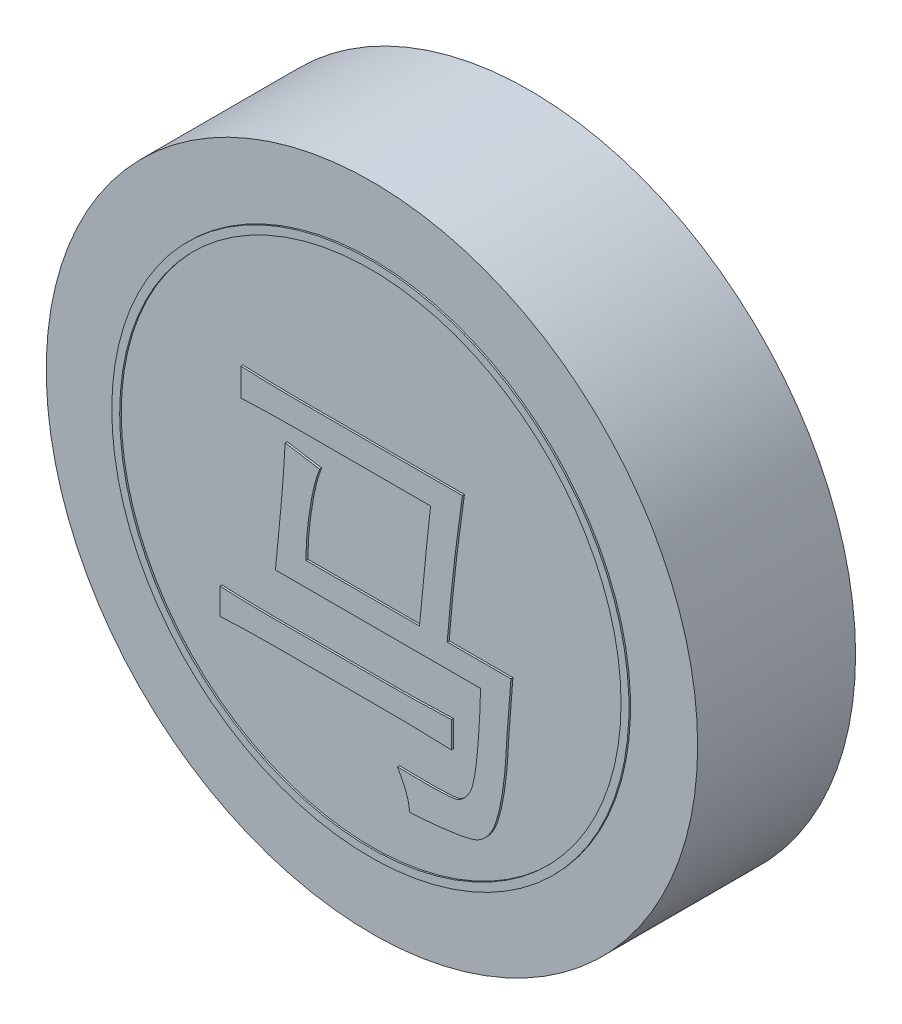
from build123d import *

# Parameters (mm, degrees)
SKETCH_1_R               = 16.5
DIAMETER33_HEIGHT8_DEPTH = 8
CHARACTER_DEPTH          = 0.1
SKETCH_3_R               = 13.1
SKETCH_3_R_2             = 12.7
INK_RING_DEPTH           = 0.08


with BuildPart() as part:
    # 草图1 → Diameter33_Height8 (new body)
    with BuildSketch(Plane.XY):
        Circle(SKETCH_1_R)
    extrude(amount=-DIAMETER33_HEIGHT8_DEPTH)

    # 草图2 → Character_马 (add)
    with BuildSketch(Plane.XY):
        with BuildLine():
            add(Edge.make_bspline(
                [(-2.543859649, 2.657894737), (-2.568109523, 2.601908638), (-2.618944351, 2.484545403), (-2.68091831, 2.29374228), (-2.747882739, 2.084905171), (-2.809197893, 1.853949883), (-2.867938942, 1.601351852), (-2.929388828, 1.329074257), (-2.981674213, 1.034530608), (-3.05538164, 0.620649676), (-3.127595616, 0.098084884), (-3.197623224, -0.517816396), (-3.237414282, -1.112851594), (-3.242919292, -1.502329954), (-3.245614035, -1.692982456)],
                knots=[0, 0, 0, 0, 0.495689669, 1.0391105, 1.629386371, 2.27856569, 2.980637221, 3.737641002, 4.547078417, 5.411969332, 7.15491927, 8.834024839, 10.450232028, 12, 12, 12, 12], degree=3))
            Line((-3.245614035, -1.692982456), (2.50877193, -1.692982456))
            add(Edge.make_bspline(
                [(2.50877193, -1.692982456), (2.555842668, -1.219109546), (2.651092154, -0.26020911), (2.765765857, 0.939059138), (2.857689962, 1.892225125), (2.928191701, 2.576627854), (2.997770846, 3.225611417), (3.046502797, 3.646446892), (3.070175439, 3.850877193)],
                knots=[0, 0, 0, 0, 1.538264342, 3.112738277, 3.891618687, 4.631513556, 5.335226919, 6, 6, 6, 6], degree=3))
            Line((3.070175439, 3.850877193), (-3.666666667, 3.850877193))
            add(Edge.make_bspline(
                [(-3.666666667, 3.850877193), (-3.893660384, 3.849684604), (-4.355478431, 3.847258285), (-5.06158577, 3.833290973), (-5.793776141, 3.813732), (-6.290908298, 3.791840575), (-6.543859649, 3.780701754)],
                knots=[0, 0, 0, 0, 0.946376728, 1.925400653, 2.944399995, 4, 4, 4, 4], degree=3))
            Line((-6.543859649, 3.780701754), (-6.543859649, 5.184210526))
            add(Edge.make_bspline(
                [(-6.543859649, 5.184210526), (-6.290908298, 5.173071706), (-5.793776141, 5.15118028), (-5.06158577, 5.131621308), (-4.355478431, 5.117653996), (-3.893660384, 5.115227677), (-3.666666667, 5.114035088)],
                knots=[0, 0, 0, 0, 1.055600005, 2.074599347, 3.053623272, 4, 4, 4, 4], degree=3))
            Line((-3.666666667, 5.114035088), (4.684210526, 5.114035088))
            add(Edge.make_bspline(
                [(4.684210526, 5.114035088), (4.594389665, 4.480170947), (4.4139847, 3.207056477), (4.243054526, 1.774416685), (4.14478495, 0.828967937), (4.097381465, 0.388144624), (4.055421695, -0.025950303), (4.020061293, -0.412530658), (3.985399458, -0.77104386), (3.956533585, -1.101987754), (3.933708028, -1.406199086), (3.919206962, -1.600281379), (3.912280702, -1.692982456)],
                knots=[0, 0, 0, 0, 2.802935976, 5.629689589, 6.316260642, 6.964711014, 7.570877404, 8.13855511, 8.664335647, 9.147876972, 9.592993668, 10, 10, 10, 10], degree=3))
            Line((3.912280702, -1.692982456), (7.140350877, -1.692982456))
            add(Edge.make_bspline(
                [(7.140350877, -1.692982456), (7.117496771, -1.957195671), (7.070752869, -2.497595555), (7.005207646, -3.329223298), (6.94597212, -4.200007765), (6.901683429, -4.946124678), (6.868307152, -5.546229635), (6.826684596, -5.980862849), (6.785382047, -6.39647152), (6.728695376, -6.792040318), (6.670245675, -7.168463089), (6.603590191, -7.526033406), (6.524025139, -7.862448123), (6.444320105, -8.179786345), (6.348007699, -8.470700422), (6.240664659, -8.735979197), (6.112879912, -8.969541099), (5.972363355, -9.176368475), (5.813514, -9.350805736), (5.639780874, -9.496502029), (5.450674708, -9.612389616), (5.239809272, -9.700393942), (4.996758723, -9.765827824), (4.713795659, -9.832208089), (4.381558555, -9.885783366), (4.002176073, -9.941267696), (3.574948301, -9.992657478), (3.098313267, -10.039000074), (2.574062445, -10.080415008), (2.208184758, -10.1025182), (2.01754386, -10.114035088)],
                knots=[0, 0, 0, 0, 1.887044686, 3.859605311, 5.935782741, 8.09729868, 9.178245636, 10.211890598, 11.203790184, 12.149721099, 13.054774096, 13.914409008, 14.736879022, 15.514410289, 16.241554355, 16.915874949, 17.547596075, 18.132428342, 18.691003543, 19.220627564, 19.740803274, 20.262911441, 20.840419939, 21.529816771, 22.330465222, 23.233668769, 24.258284961, 25.391864306, 26.641028549, 28, 28, 28, 28], degree=3))
            add(Edge.make_bspline(
                [(2.01754386, -10.114035088), (1.999634211, -9.981554353), (1.962380573, -9.705982807), (1.828075725, -9.291338106), (1.637078715, -8.859880402), (1.472081327, -8.577306965), (1.385964912, -8.429824561)],
                knots=[0, 0, 0, 0, 0.882983811, 1.83668375, 2.870909156, 4, 4, 4, 4], degree=3))
            add(Edge.make_bspline(
                [(1.385964912, -8.429824561), (1.601684871, -8.434299725), (2.00798008, -8.44272842), (2.580650352, -8.452457271), (3.078902343, -8.449896251), (3.50262546, -8.439476904), (3.851072115, -8.425325844), (4.125715661, -8.404487351), (4.325845969, -8.373466937), (4.498441923, -8.324930212), (4.647964297, -8.219854178), (4.806608465, -8.080366), (4.946574967, -7.900402806), (5.057213348, -7.72659571), (5.135709742, -7.551771137), (5.19099419, -7.380870408), (5.241966461, -7.171945715), (5.293801136, -6.927772939), (5.340465741, -6.64505285), (5.379651802, -6.325610866), (5.42315596, -5.969892033), (5.467875091, -5.457573461), (5.519200344, -4.8262348), (5.563244909, -4.113096685), (5.591709685, -3.474461181), (5.594963512, -3.073991037), (5.596491228, -2.885964912)],
                knots=[0, 0, 0, 0, 1.758141494, 3.31135083, 4.666771348, 5.817797705, 6.764703246, 7.508656711, 8.059921999, 8.414932624, 8.957450007, 9.527295967, 10.134772448, 10.806750365, 11.201697625, 11.692819884, 12.268105713, 12.953448137, 13.726378385, 14.601998413, 15.575707604, 16.646246692, 18.791940105, 20.736977137, 22.467966827, 24, 24, 24, 24], degree=3))
            Line((5.596491228, -2.885964912), (-4.789473684, -2.885964912))
            add(Edge.make_bspline(
                [(-4.789473684, -2.885964912), (-4.742500482, -2.409482331), (-4.646861986, -1.439353083), (-4.506084048, 0.025074391), (-4.381186338, 1.489718928), (-4.325531367, 2.461946264), (-4.298245614, 2.938596491)],
                knots=[0, 0, 0, 0, 0.982838397, 2.001081075, 3.019997563, 4, 4, 4, 4], degree=3))
            add(Edge.make_bspline(
                [(-4.298245614, 2.938596491), (-4.000143593, 2.892268938), (-3.414928922, 2.801321673), (-2.830558232, 2.705101429), (-2.543859649, 2.657894737)],
                knots=[0, 0, 0, 0, 1.018778359, 2, 2, 2, 2], degree=3))
        make_face()
        with BuildLine():
            add(Edge.make_bspline(
                [(1.175438596, -5.061403509), (1.272474939, -5.06183074), (1.474359506, -5.062719598), (1.787949201, -5.055481089), (2.124128563, -5.051460824), (2.48108109, -5.043574331), (2.860490404, -5.031942174), (3.261734399, -5.023647615), (3.685265265, -5.005984943), (3.974652272, -4.996224852), (4.122807018, -4.99122807)],
                knots=[0, 0, 0, 0, 0.789853886, 1.643294733, 2.553146486, 3.526589248, 4.549556957, 5.643022245, 6.793320254, 8, 8, 8, 8], degree=3))
            Line((4.122807018, -4.99122807), (4.122807018, -6.324561404))
            add(Edge.make_bspline(
                [(4.122807018, -6.324561404), (3.969453719, -6.319579397), (3.671400907, -6.309896522), (3.237471852, -6.292228161), (2.829302521, -6.283816356), (2.447289567, -6.272341119), (2.09207297, -6.264362463), (1.762823851, -6.260344735), (1.460498309, -6.253100348), (1.267276772, -6.253971776), (1.175438596, -6.254385965)],
                knots=[0, 0, 0, 0, 1.248975298, 2.427470434, 3.535041912, 4.572114753, 5.538512415, 6.427215019, 7.252455469, 8, 8, 8, 8], degree=3))
            Line((1.175438596, -6.254385965), (-5.070175439, -6.254385965))
            add(Edge.make_bspline(
                [(-5.070175439, -6.254385965), (-5.298037146, -6.255493864), (-5.742534486, -6.257655079), (-6.391477007, -6.271227092), (-7.005930309, -6.290151347), (-7.403331701, -6.313306629), (-7.596491228, -6.324561404)],
                knots=[0, 0, 0, 0, 1.081761786, 2.110228356, 3.081464224, 4, 4, 4, 4], degree=3))
            Line((-7.596491228, -6.324561404), (-7.596491228, -4.99122807))
            add(Edge.make_bspline(
                [(-7.596491228, -4.99122807), (-7.403331701, -5.002482845), (-7.005930309, -5.025638127), (-6.391477007, -5.044562382), (-5.742534486, -5.058134395), (-5.298037146, -5.06029561), (-5.070175439, -5.061403509)],
                knots=[0, 0, 0, 0, 0.918535776, 1.889771644, 2.918238214, 4, 4, 4, 4], degree=3))
            Line((-5.070175439, -5.061403509), (1.175438596, -5.061403509))
        make_face()
    extrude(amount=CHARACTER_DEPTH)

    # 草图3 → Ink_ring (add)
    with BuildSketch(Plane.XY):
        with Locations(Location((0, 0, 0), (0, 0, 180))):
            Circle(SKETCH_3_R)
        with Locations(Location((0, 0, 0), (0, 0, 180))):
            Circle(SKETCH_3_R_2, mode=Mode.SUBTRACT)
    extrude(amount=INK_RING_DEPTH)


solid = part.part
